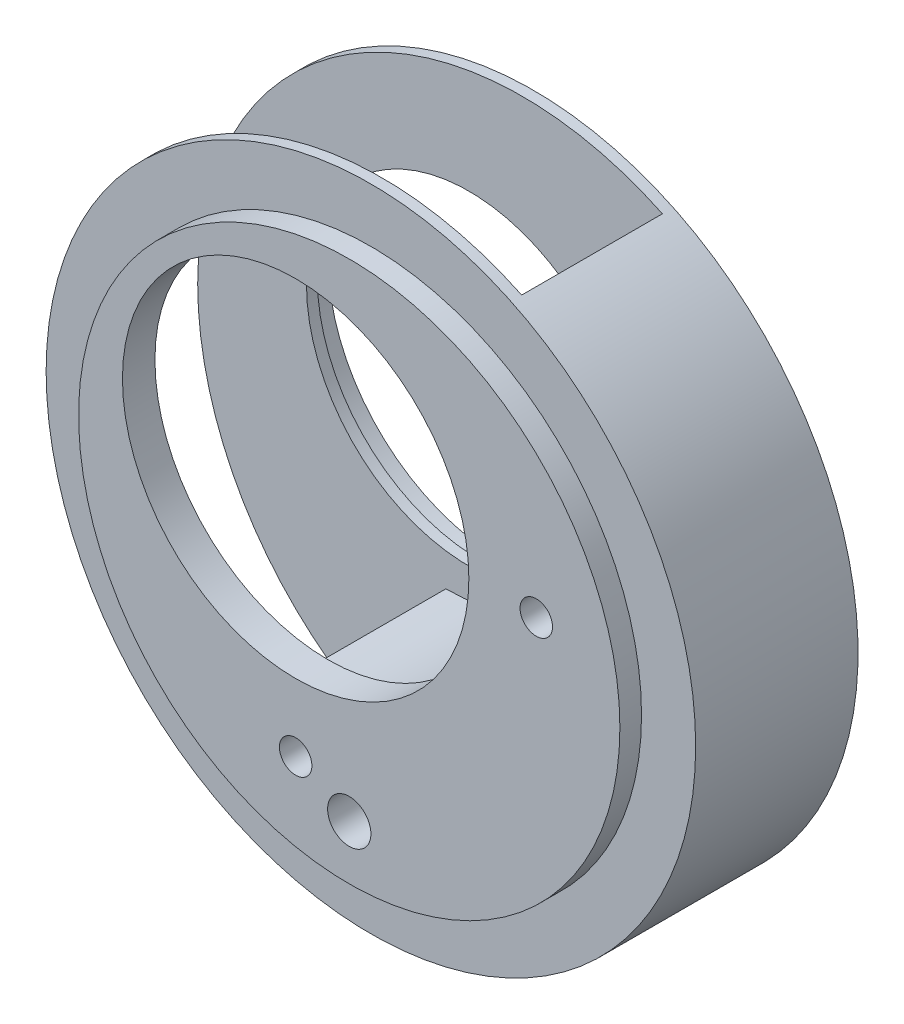
from build123d import *

# Parameters (mm, degrees)
SKETCH1_R           = 30
BOSS_EXTRUDE1_DEPTH = 19
CUT_EXTRUDE1_START  = -2
SKETCH2_R           = 30
SKETCH2_R_2         = 25
CUT_EXTRUDE1_DEPTH  = 2
SKETCH3_R           = 30
SKETCH3_R_2         = 25
CUT_EXTRUDE2_DEPTH  = 2
CUT_EXTRUDE3_DEPTH  = 6.5
CUT_EXTRUDE4_REACH  = 48.487
SKETCH11_R          = 16
CUT_EXTRUDE5_REACH  = 48.487
SKETCH12_R          = 15
CUT_EXTRUDE6_START  = -2
SKETCH13_R          = 16
CUT_EXTRUDE6_DEPTH  = 2
SKETCH14_R          = 2
CUT_EXTRUDE7_DEPTH  = 3
CUT_EXTRUDE8_START  = -3
SKETCH15_R          = 1.5
SKETCH15_R_2        = 15
CUT_EXTRUDE8_DEPTH  = 3


with BuildPart() as part:
    # Sketch1 → Boss-Extrude1 (new body)
    with BuildSketch(Plane.XY):
        Circle(SKETCH1_R)
    extrude(amount=BOSS_EXTRUDE1_DEPTH)

    # Sketch2 → Cut-Extrude1 (cut)
    with BuildSketch(Plane.XY.offset(19).offset(CUT_EXTRUDE1_START)):
        Circle(SKETCH2_R)
        Circle(SKETCH2_R_2, mode=Mode.SUBTRACT)
    extrude(amount=CUT_EXTRUDE1_DEPTH, mode=Mode.SUBTRACT)

    # Sketch3 → Cut-Extrude2 (cut)
    with BuildSketch(Plane(origin=(0, 0, 0), x_dir=(-1, 0, 0), z_dir=(0, 0, -1))):
        Circle(SKETCH3_R)
        with Locations(Location((0, 0, 0), (0, 0, 180))):
            Circle(SKETCH3_R_2, mode=Mode.SUBTRACT)
    extrude(amount=-CUT_EXTRUDE2_DEPTH, mode=Mode.SUBTRACT)

    # Sketch10 → Cut-Extrude3 (cut, symmetric)
    with BuildSketch(Plane.XY.offset(9.5)):
        with BuildLine():
            Line((-7.071067812, -12.928932188), (-7.071067812, -29.154759474))
            ThreePointArc((-7.071067812, -29.154759474), (-28.265076636, 10.054125657), (12.928932188, 27.071067812))
            Line((12.928932188, 27.071067812), (7.071067812, 21.213203436))
            ThreePointArc((7.071067812, 21.213203436), (11.406522838, -0.582600835), (-7.071067812, -12.928932188))
        make_face()
    extrude(amount=CUT_EXTRUDE3_DEPTH, both=True, mode=Mode.SUBTRACT)

    # Sketch11 → Cut-Extrude4 (cut, up to next)
    with BuildSketch(Plane.XY.offset(19), mode=Mode.PRIVATE) as cut_extrude4_sk1:
        with Locations((-4.949747468, 4.949747468)):
            Circle(SKETCH11_R)
    cut_extrude4_tool1 = extrude(cut_extrude4_sk1.sketch, amount=-CUT_EXTRUDE4_REACH, mode=Mode.PRIVATE) & part.part
    add(cut_extrude4_tool1.solids().sort_by_distance((-4.949747, 4.949747, 19))[0], mode=Mode.SUBTRACT)

    # Sketch12 → Cut-Extrude5 (cut, up to next)
    with BuildSketch(Plane(origin=(0, 0, 0), x_dir=(-1, 0, 0), z_dir=(0, 0, -1)), mode=Mode.PRIVATE) as cut_extrude5_sk1:
        with Locations((4.949747468, 4.949747468)):
            Circle(SKETCH12_R)
    cut_extrude5_tool1 = extrude(cut_extrude5_sk1.sketch, amount=-CUT_EXTRUDE5_REACH, mode=Mode.PRIVATE) & part.part
    add(cut_extrude5_tool1.solids().sort_by_distance((-4.949747, 4.949747, 0))[0], mode=Mode.SUBTRACT)

    # Sketch13 → Cut-Extrude6 (cut)
    with BuildSketch(Plane(origin=(0, 0, 0), x_dir=(-1, 0, 0), z_dir=(0, 0, -1)).offset(CUT_EXTRUDE6_START)):
        with Locations(Location((4.949747468, 4.949747468, 0), (0, 0, 180))):
            Circle(SKETCH13_R)
    extrude(amount=CUT_EXTRUDE6_DEPTH, mode=Mode.SUBTRACT)

    # Sketch14 → Cut-Extrude7 (cut)
    with BuildSketch(Plane.XY.offset(19)):
        with Locations((0, -20)):
            Circle(SKETCH14_R)
    extrude(amount=-CUT_EXTRUDE7_DEPTH, mode=Mode.SUBTRACT)

    # Sketch15 → Cut-Extrude8 (cut)
    with BuildSketch(Plane.XY.offset(19).offset(CUT_EXTRUDE8_START)):
        with Locations((-4.949747468, -17.277677021)):
            Circle(SKETCH15_R)
        with Locations(Location((-4.949747468, 4.949747468, 0), (0, 0, 180))):
            Circle(SKETCH15_R_2)
        with Locations((17.277677021, 4.949747468)):
            Circle(SKETCH15_R)
    extrude(amount=CUT_EXTRUDE8_DEPTH, mode=Mode.SUBTRACT)


solid = part.part
